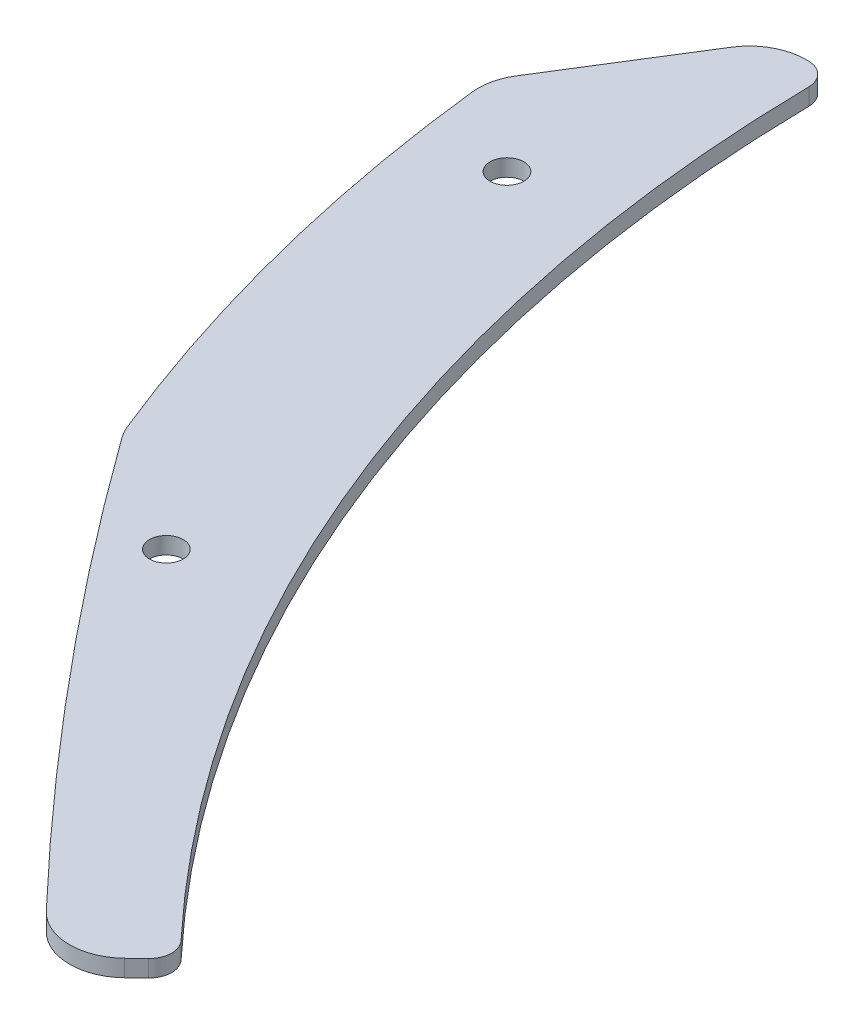
from build123d import *

# Parameters (mm, degrees)
ESQUISSE1_R             = 1.5
BOSS_EXTRU_1_DEPTH      = 1.5
ENL_V_MAT_EXTRU_1_DEPTH = 189.733992158
CONG_1_R                = 5
CONG_2_R                = 2


with BuildPart() as part:
    # Esquisse1 → Boss.-Extru.1 (new body)
    with BuildSketch(Plane(origin=(0, 0, 0), x_dir=(1, 0, 0), z_dir=(0, 1, 0))):
        with BuildLine():
            Line((-155, 0), (-139.5, 0))
            ThreePointArc((-139.5, 0), (-129.342147712, -52.257619782), (-100.347902147, -96.904842679))
            Line((-100.347902147, -96.904842679), (-111.497669052, -107.672047421))
            ThreePointArc((-111.497669052, -107.672047421), (-143.713497458, -58.064021979), (-155, 0))
        make_face()
        with Locations(Location((-146.374347778, -21.875792847, 0), (0, 0, 270))):
            Circle(ESQUISSE1_R, mode=Mode.SUBTRACT)
        with Locations(Location((-132.450285517, -66.03727634, 0), (0, 0, 270))):
            Circle(ESQUISSE1_R, mode=Mode.SUBTRACT)
    extrude(amount=BOSS_EXTRU_1_DEPTH)

    # Esquisse2 → Enlèv. mat.-Extru.1 (cut, through all)
    with BuildSketch(Plane(origin=(0, 1.5, 0), x_dir=(1, 0, 0), z_dir=(0, 1, 0))):
        with BuildLine():
            Line((-155, 0), (-144.5, 0))
            Line((-144.5, 0), (-154.217397717, -15.556164093))
            ThreePointArc((-154.217397717, -15.556164093), (-154.804225792, -7.78791865), (-155, 0))
        make_face()
        with BuildLine():
            Line((-106.461511638, -102.808686738), (-111.497669052, -107.672047421))
            ThreePointArc((-111.497669052, -107.672047421), (-129.740451706, -84.808108051), (-143.363022468, -58.924051021))
            ThreePointArc((-143.363022468, -58.924051021), (-125.74115641, -81.563361553), (-106.461511638, -102.808686738))
        make_face()
    extrude(amount=-ENL_V_MAT_EXTRU_1_DEPTH, mode=Mode.SUBTRACT)

    # Congé1
    cong_1_edges = [part.edges().sort_by_distance(p)[0] for p in [
        (-154.217397717, 0.75, 15.556164093),
        (-144.5, 0.75, 0),
        (-143.363022468, 0.75, 58.924051021),
        (-106.461511638, 0.75, 102.808686738),
    ]]
    fillet(cong_1_edges, radius=CONG_1_R)

    # Congé2
    cong_2_edges = [part.edges().sort_by_distance(p)[0] for p in [
        (-100.347902147, 0.75, 96.904842679),
        (-139.5, 0.75, 0),
    ]]
    fillet(cong_2_edges, radius=CONG_2_R)


solid = part.part
